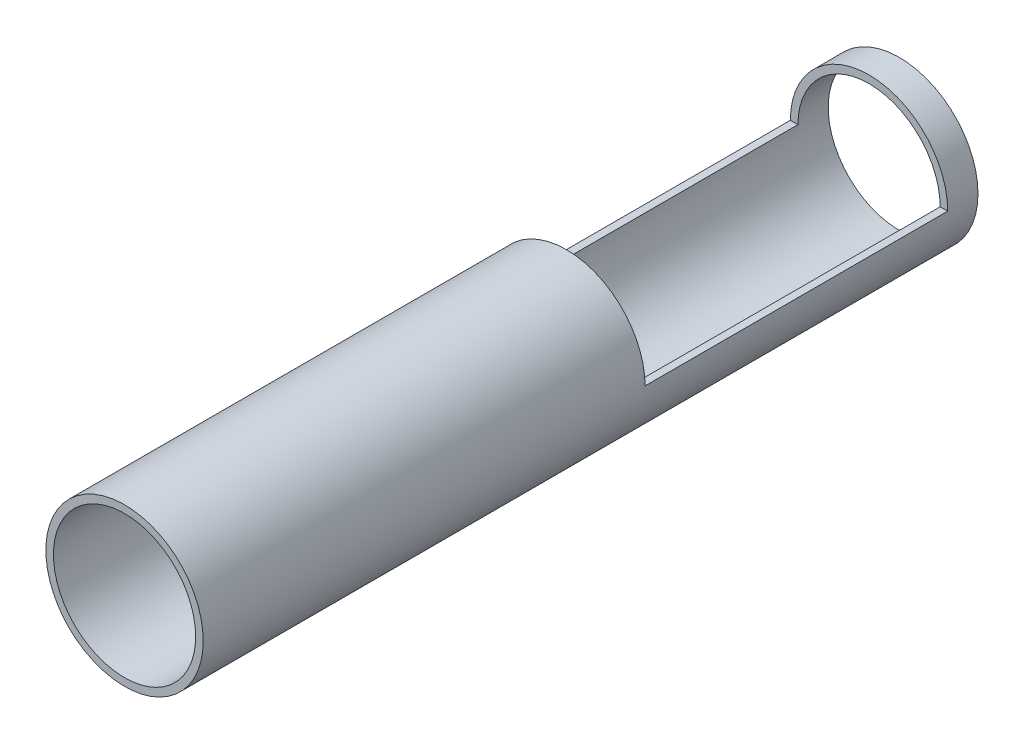
from build123d import *

# Parameters (mm, degrees)
CROQUIS1_R                 = 13
CROQUIS1_R_2               = 11.75
SALIENTE_EXTRUIR1_DEPTH    = 128
CORTAR_EXTRUIR1_DEPTH      = 130.313572374
CORTAR_EXTRUIR1_DEPTH_BACK = 130.313572374
CROQUIS2_W                 = 50
CROQUIS2_H                 = 17.645366616


with BuildPart() as part:
    # Croquis1 → Saliente-Extruir1 (new body)
    with BuildSketch(Plane.XY):
        Circle(CROQUIS1_R)
        Circle(CROQUIS1_R_2, mode=Mode.SUBTRACT)
    extrude(amount=SALIENTE_EXTRUIR1_DEPTH)

    # Croquis2 → Cortar-Extruir1 (cut, two sides: drawn at the far end of the back side and taken through both)
    with BuildSketch(Plane(origin=(0, 0, 0), x_dir=(0, 0, -1), z_dir=(1, 0, 0)).offset(-CORTAR_EXTRUIR1_DEPTH_BACK)):
        with Locations((-30, 8.822683308)):
            Rectangle(CROQUIS2_W, CROQUIS2_H)
    extrude(amount=CORTAR_EXTRUIR1_DEPTH + CORTAR_EXTRUIR1_DEPTH_BACK, mode=Mode.SUBTRACT)


solid = part.part
